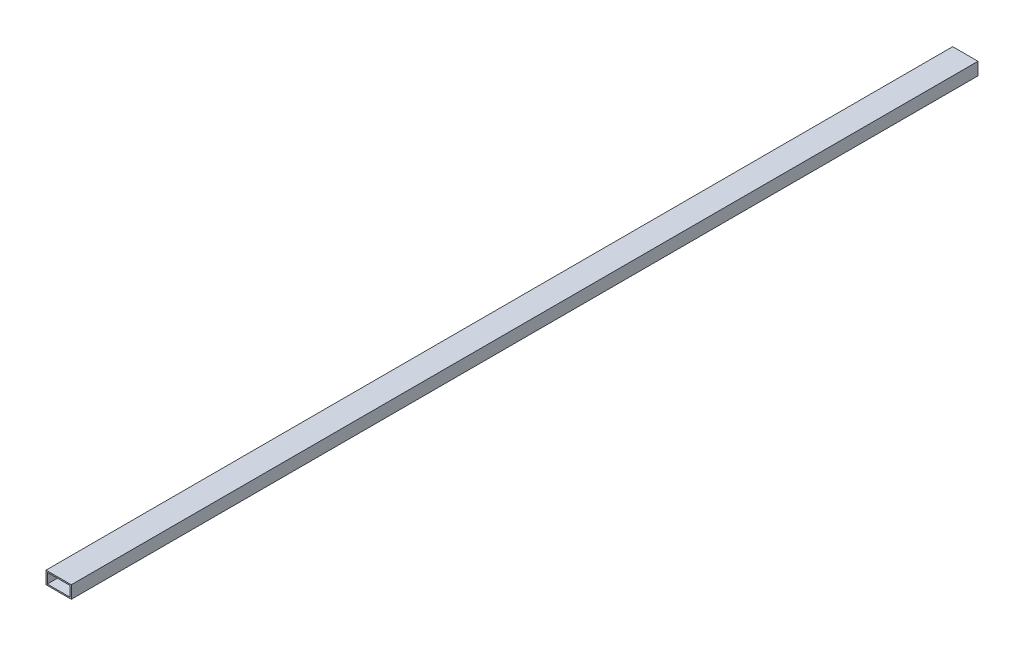
from build123d import *

# Parameters (mm, degrees)
CROQUIS1_W            = 40
CROQUIS1_H            = 20
CROQUIS1_W_2          = 36
CROQUIS1_H_2          = 16
EXTRUIR_L_MINA1_DEPTH = 1433


with BuildPart() as part:
    # Croquis1 → Extruir-Lámina1 (new body)
    with BuildSketch(Plane.XY):
        Rectangle(CROQUIS1_W, CROQUIS1_H)
        Rectangle(CROQUIS1_W_2, CROQUIS1_H_2, mode=Mode.SUBTRACT)
    extrude(amount=EXTRUIR_L_MINA1_DEPTH)


solid = part.part
